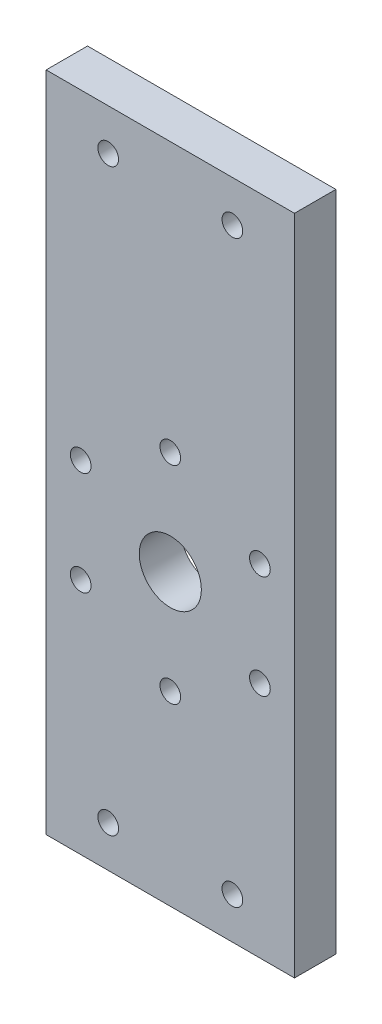
from build123d import *

# Parameters (mm, degrees)
SKETCH1_W           = 76.2
SKETCH1_H           = 203.2
BOSS_EXTRUDE1_DEPTH = 12.7
SKETCH2_R           = 3.175
CUT_EXTRUDE1_DEPTH  = 12.7
SKETCH3_R           = 9.525
CUT_EXTRUDE2_DEPTH  = 12.7
SKETCH4_R           = 3.175
CUT_EXTRUDE3_DEPTH  = 12.7


with BuildPart() as part:
    # Sketch1 → Boss-Extrude1 (new body)
    with BuildSketch(Plane.XY):
        with Locations((38.1, 101.6)):
            Rectangle(SKETCH1_W, SKETCH1_H)
    extrude(amount=BOSS_EXTRUDE1_DEPTH)

    # Sketch2 → Cut-Extrude1 (cut)
    with BuildSketch(Plane(origin=(0, 0, 0), x_dir=(-1, 0, 0), z_dir=(0, 0, -1))):
        with Locations((-57.15, 190.5)):
            Circle(SKETCH2_R)
        with Locations((-19.05, 190.5)):
            Circle(SKETCH2_R)
        with Locations((-19.05, 12.7)):
            Circle(SKETCH2_R)
        with Locations((-57.15, 12.7)):
            Circle(SKETCH2_R)
    extrude(amount=-CUT_EXTRUDE1_DEPTH, mode=Mode.SUBTRACT)

    # Sketch3 → Cut-Extrude2 (cut)
    with BuildSketch(Plane.XY.offset(12.7)):
        with Locations((38.1, 88.9)):
            Circle(SKETCH3_R)
    extrude(amount=-CUT_EXTRUDE2_DEPTH, mode=Mode.SUBTRACT)

    # Sketch4 → Cut-Extrude3 (cut)
    with BuildSketch(Plane.XY.offset(12.7)):
        with Locations((38.1, 120.65)):
            Circle(SKETCH4_R)
        with Locations((65.59630657, 104.775)):
            Circle(SKETCH4_R)
        with Locations((65.59630657, 73.025)):
            Circle(SKETCH4_R)
        with Locations((38.1, 57.15)):
            Circle(SKETCH4_R)
        with Locations((10.60369343, 73.025)):
            Circle(SKETCH4_R)
        with Locations((10.60369343, 104.775)):
            Circle(SKETCH4_R)
    extrude(amount=-CUT_EXTRUDE3_DEPTH, mode=Mode.SUBTRACT)


solid = part.part
